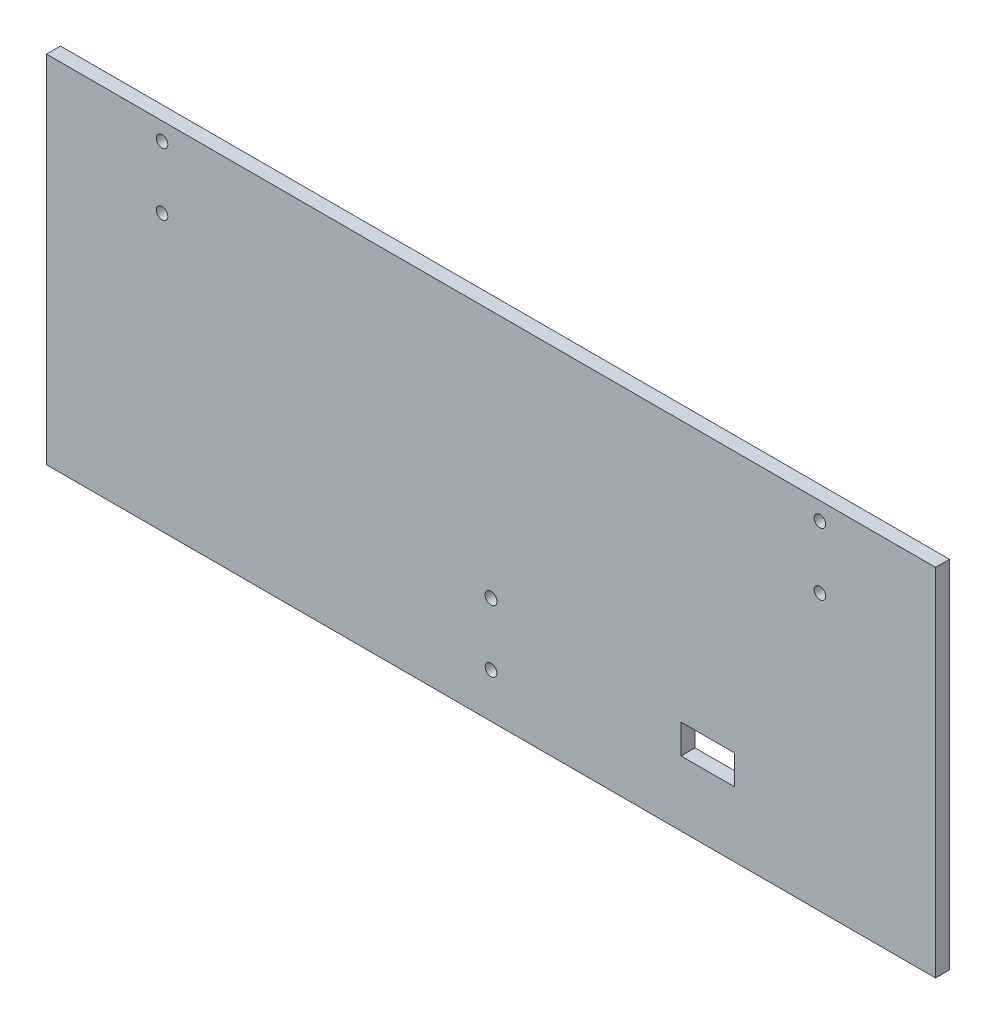
from build123d import *

# Parameters (mm, degrees)
SKETCH1_W           = 254
SKETCH1_H           = 101.6
SKETCH1_R           = 1.651
SKETCH1_R_2         = 1.6891
SKETCH1_R_3         = 1.6637
SKETCH1_W_2         = 15.2908
SKETCH1_H_2         = 8.382
BOSS_EXTRUDE1_DEPTH = 4


with BuildPart() as part:
    # Sketch1 → Boss-Extrude1 (new body)
    with BuildSketch(Plane.XY):
        with Locations((127, 50.8)):
            Rectangle(SKETCH1_W, SKETCH1_H)
        with Locations((33.02, 96.524607502)):
            Circle(SKETCH1_R, mode=Mode.SUBTRACT)
        with Locations((33.019999679, 78.744607502)):
            Circle(SKETCH1_R, mode=Mode.SUBTRACT)
        with Locations((127, 30.48)):
            Circle(SKETCH1_R_2, mode=Mode.SUBTRACT)
        with Locations((127, 12.7)):
            Circle(SKETCH1_R_3, mode=Mode.SUBTRACT)
        with Locations((220.98, 96.52)):
            Circle(SKETCH1_R, mode=Mode.SUBTRACT)
        with Locations((220.98, 78.74)):
            Circle(SKETCH1_R, mode=Mode.SUBTRACT)
        with Locations((188.930978973, 22.780591914)):
            Rectangle(SKETCH1_W_2, SKETCH1_H_2, mode=Mode.SUBTRACT)
    extrude(amount=BOSS_EXTRUDE1_DEPTH)


solid = part.part
